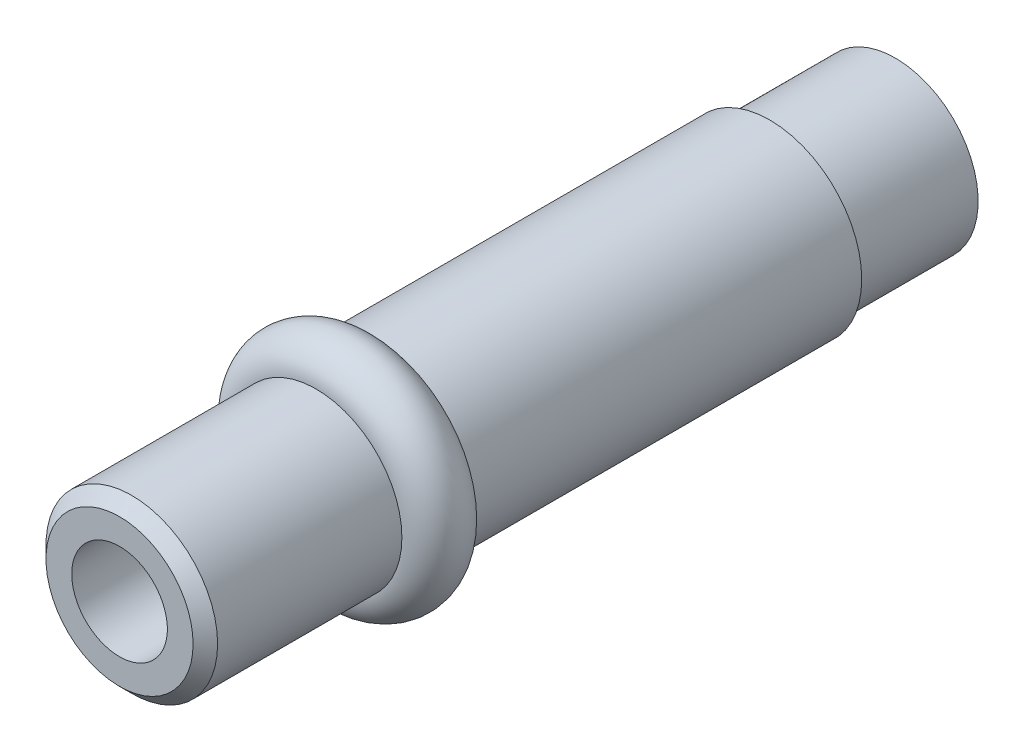
from build123d import *

# Parameters (mm, degrees)
SKETCH1_R           = 3.81
BOSS_EXTRUDE1_DEPTH = 32.1564
SKETCH2_R           = 1.9812
CUT_EXTRUDE1_DEPTH  = 33.604696916
SKETCH3_R           = 3.81
SKETCH3_R_2         = 3.429
CUT_EXTRUDE2_DEPTH  = 5.207
CUT_EXTRUDE3_START  = -9.652
SKETCH4_R           = 3.81
SKETCH4_R_2         = 3.556
CUT_EXTRUDE3_DEPTH  = 9.652
CHAMFER1_SIZE       = 0.508


with BuildPart() as part:
    # Sketch1 → Boss-Extrude1 (new body)
    with BuildSketch(Plane.XY):
        Circle(SKETCH1_R)
    extrude(amount=BOSS_EXTRUDE1_DEPTH)

    # Sketch2 → Cut-Extrude1 (cut, through all)
    with BuildSketch(Plane(origin=(0, 0, 0), x_dir=(-1, 0, 0), z_dir=(0, 0, -1))):
        Circle(SKETCH2_R)
    extrude(amount=-CUT_EXTRUDE1_DEPTH, mode=Mode.SUBTRACT)

    # Sketch3 → Cut-Extrude2 (cut)
    with BuildSketch(Plane(origin=(0, 0, 0), x_dir=(-1, 0, 0), z_dir=(0, 0, -1))):
        Circle(SKETCH3_R)
        Circle(SKETCH3_R_2, mode=Mode.SUBTRACT)
    extrude(amount=-CUT_EXTRUDE2_DEPTH, mode=Mode.SUBTRACT)

    # Sketch4 → Cut-Extrude3 (cut)
    with BuildSketch(Plane.XY.offset(32.1564).offset(CUT_EXTRUDE3_START)):
        with Locations(Location((0, 0, 0), (0, 0, 180))):
            Circle(SKETCH4_R)
        Circle(SKETCH4_R_2, mode=Mode.SUBTRACT)
    extrude(amount=CUT_EXTRUDE3_DEPTH, mode=Mode.SUBTRACT)

    # Sketch5 → Revolve1 (revolve)
    with BuildSketch(Plane(origin=(0, 0, 0), x_dir=(1, 0, 0), z_dir=(0, 1, 0))):
        with BuildLine():
            Line((3.556, -24.009676403), (3.269595119, -21.452809))
            Line((3.269595119, -21.452809), (3.81, -21.452809))
            ThreePointArc((3.81, -21.452809), (4.81966386, -22.844159242), (3.556, -24.009676403))
        make_face()
    revolve(axis=Axis((0, 0, 32.1564), (0, 0, -1)))

    # Chamfer1
    chamfer1_edges = [part.edges().sort_by_distance(p)[0] for p in [
        (-3.556, 0, 32.1564),
    ]]
    chamfer(chamfer1_edges, length=CHAMFER1_SIZE)


solid = part.part
